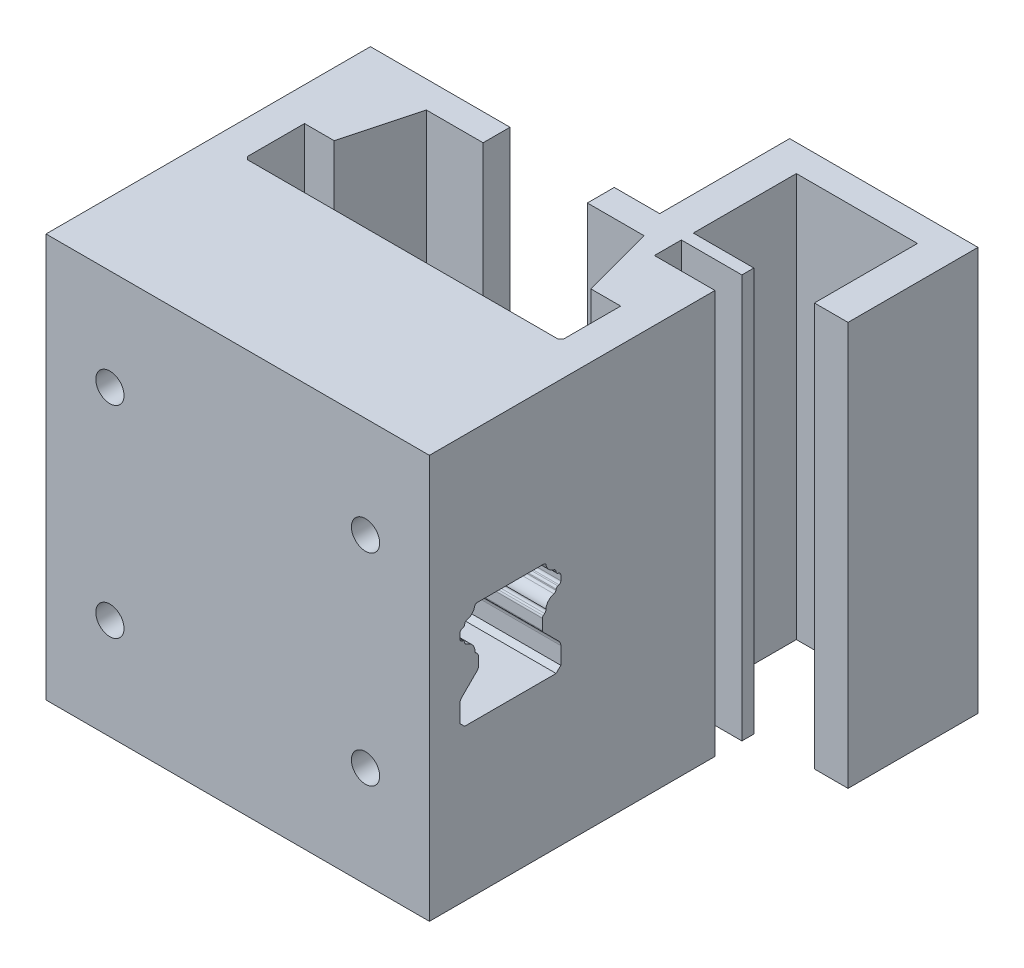
from build123d import *

# Parameters (mm, degrees)
SKETCH1_W           = 57
SKETCH1_H           = 28.7
BOSS_EXTRUDE1_DEPTH = 60
SKETCH2_W           = 9
SKETCH2_H           = 4
CUT_EXTRUDE1_DEPTH  = 69.064473112
BOSS_EXTRUDE2_DEPTH = 28.5
SKETCH6_W           = 15.5
SKETCH6_H           = 15.390476131
CUT_EXTRUDE2_DEPTH  = 80
BOSS_EXTRUDE5_DEPTH = 60
SKETCH10_R          = 2.1
CUT_EXTRUDE3_DEPTH  = 24.530533394
SKETCH11_W          = 40.163550966
SKETCH11_H          = 20.084690285
CUT_EXTRUDE4_DEPTH  = 82.168165413
SKETCH12_W          = 9
SKETCH12_H          = 4
BOSS_EXTRUDE6_DEPTH = 60


with BuildPart() as part:
    # Sketch1 → Boss-Extrude1 (new body)
    with BuildSketch(Plane(origin=(0, 0, 0), x_dir=(1, 0, 0), z_dir=(0, 1, 0))):
        with Locations((0, -0.5)):
            Rectangle(SKETCH1_W, SKETCH1_H)
        Polygon((23.07, -9.85), (-23.07, -9.85), (-23.5, -9.42), (-23.5, -0.95), (-19.09385128, -0.95), (-19, -0.599742255), (-16.2, 9.85), (16.2, 9.85), (19, -0.599742255), (19.09385128, -0.95), (23.5, -0.95), (23.5, -2.9), (23.5, -9.42), align=None, mode=Mode.SUBTRACT)
    extrude(amount=BOSS_EXTRUDE1_DEPTH)

    # Sketch2 → Cut-Extrude1 (cut, through all)
    with BuildSketch(Plane.XZ):
        with Locations((24, -10.0706285)):
            Rectangle(SKETCH2_W, SKETCH2_H)
        with Locations((-24, -10.0706285)):
            Rectangle(SKETCH2_W, SKETCH2_H)
    extrude(amount=-CUT_EXTRUDE1_DEPTH, mode=Mode.SUBTRACT)

    # Sketch5 → Boss-Extrude2 (add, symmetric)
    with BuildSketch(Plane(origin=(0, 0, 0), x_dir=(0, 0, -1), z_dir=(1, 0, 0))):
        with BuildLine():
            Line((-14.85, 0), (-14.85, 23.200000017))
            Line((-14.85, 23.200000017), (-15.549999973, 22.50000003))
            Line((-15.549999973, 22.50000003), (-29.149999973, 22.50000003))
            Line((-29.149999973, 22.50000003), (-29.849999973, 23.20000003))
            Line((-29.849999973, 23.20000003), (-29.849999973, 25.743360053))
            ThreePointArc((-29.849999973, 25.743360053), (-29.773879502, 26.126043492), (-29.557106746, 26.450466847))
            Line((-29.557106746, 26.450466847), (-27.237157266, 28.770416328))
            ThreePointArc((-27.237157266, 28.770416328), (-27.150448162, 28.900185674), (-27.119999973, 29.053259055))
            Line((-27.119999973, 29.053259055), (-27.119999973, 30.615319642))
            ThreePointArc((-27.119999973, 30.615319642), (-27.150448164, 30.768393021), (-27.237157268, 30.898162365))
            Line((-27.237157268, 30.898162365), (-27.431588163, 31.09259326))
            ThreePointArc((-27.431588163, 31.09259326), (-27.613507965, 31.297692563), (-27.620638933, 31.57175403))
            ThreePointArc((-27.620638933, 31.57175403), (-28.017573243, 32.42857618), (-28.828543655, 32.91234062))
            ThreePointArc((-28.828543655, 32.91234062), (-29.01918836, 33.020436377), (-29.124259054, 33.212764861))
            Line((-29.124259054, 33.212764861), (-29.156235284, 33.354092333))
            ThreePointArc((-29.156235284, 33.354092333), (-29.24659278, 33.53064407), (-29.410649592, 33.642090719))
            Line((-29.410649592, 33.642090719), (-29.585724304, 33.70524196))
            ThreePointArc((-29.585724304, 33.70524196), (-29.777329878, 33.851609246), (-29.849999973, 34.081511694))
            Line((-29.849999973, 34.081511694), (-29.849999973, 34.837490602))
            ThreePointArc((-29.849999973, 34.837490602), (-29.772088513, 35.074680338), (-29.568705112, 35.219471078))
            Line((-29.568705112, 35.219471078), (-29.427668799, 35.263299846))
            ThreePointArc((-29.427668799, 35.263299846), (-29.25116358, 35.375371369), (-29.155313737, 35.561185593))
            Line((-29.155313737, 35.561185593), (-29.125010632, 35.702102112))
            ThreePointArc((-29.125010632, 35.702102112), (-29.020526118, 35.897067182), (-28.828406063, 36.006695082))
            ThreePointArc((-28.828406063, 36.006695082), (-28.025619489, 36.481556021), (-27.62403672, 37.32339358))
            ThreePointArc((-27.62403672, 37.32339358), (-27.540484938, 37.407225271), (-27.43605838, 37.46293655))
            Line((-27.43605838, 37.46293655), (-27.39899493, 37.5))
            Line((-27.39899493, 37.5), (-17.30100503, 37.5))
            Line((-17.30100503, 37.5), (-17.26394158, 37.46293655))
            ThreePointArc((-17.26394158, 37.46293655), (-17.159515017, 37.407225278), (-17.07596324, 37.32339358))
            ThreePointArc((-17.07596324, 37.32339358), (-16.674380468, 36.481556018), (-15.871593887, 36.006695079))
            ThreePointArc((-15.871593887, 36.006695079), (-15.679473839, 35.897067189), (-15.574989331, 35.702102127))
            Line((-15.574989331, 35.702102127), (-15.544686222, 35.561185587))
            ThreePointArc((-15.544686222, 35.561185587), (-15.448836377, 35.375371364), (-15.272331158, 35.263299843))
            Line((-15.272331158, 35.263299843), (-15.131294869, 35.219471083))
            ThreePointArc((-15.131294869, 35.219471083), (-14.927911462, 35.074680333), (-14.85, 34.837490586))
            Line((-14.85, 34.837490586), (-14.85, 60))
            Line((-14.85, 60), (-34.380533394, 60))
            Line((-34.380533394, 60), (-34.380533394, 0))
            Line((-34.380533394, 0), (-14.85, 0))
        make_face()
        with BuildLine():
            ThreePointArc((-15.142893227, 26.450466847), (-14.926120471, 26.126043492), (-14.85, 25.743360053))
            Line((-14.85, 25.743360053), (-14.85, 34.081511674))
            ThreePointArc((-14.85, 34.081511674), (-14.922670087, 33.851609245), (-15.114275644, 33.70524197))
            Line((-15.114275644, 33.70524197), (-15.289350386, 33.642090718))
            ThreePointArc((-15.289350386, 33.642090718), (-15.453407192, 33.53064407), (-15.543764688, 33.354092339))
            Line((-15.543764688, 33.354092339), (-15.57574092, 33.21276486))
            ThreePointArc((-15.57574092, 33.21276486), (-15.680811613, 33.020436377), (-15.871456319, 32.91234062))
            ThreePointArc((-15.871456319, 32.91234062), (-16.68242673, 32.42857618), (-17.07936104, 31.57175403))
            ThreePointArc((-17.07936104, 31.57175403), (-17.086492012, 31.297692565), (-17.26841181, 31.09259326))
            Line((-17.26841181, 31.09259326), (-17.462842708, 30.898162362))
            ThreePointArc((-17.462842708, 30.898162362), (-17.549551812, 30.768393016), (-17.58, 30.615319635))
            Line((-17.58, 30.615319635), (-17.58, 29.053259048))
            ThreePointArc((-17.58, 29.053259048), (-17.54955181, 28.900185669), (-17.462842705, 28.770416325))
            Line((-17.462842705, 28.770416325), (-15.142893227, 26.450466847))
        make_face()
    extrude(amount=BOSS_EXTRUDE2_DEPTH, both=True)

    # Sketch6 → Cut-Extrude2 (cut)
    with BuildSketch(Plane(origin=(0, 60, 0), x_dir=(1, 0, 0), z_dir=(0, 1, 0))):
        with Locations((0, 12.050145064)):
            Rectangle(SKETCH6_W, SKETCH6_H)
    extrude(amount=-CUT_EXTRUDE2_DEPTH, mode=Mode.SUBTRACT)

    # Sketch9 → Boss-Extrude5 (add)
    with BuildSketch(Plane(origin=(0, 60, 0), x_dir=(1, 0, 0), z_dir=(0, 1, 0))):
        Polygon((-19.5, 13.85), (-19.5, 29.1706285), (-37.5, 29.1706285), (-37.5, 13.85), (-42.5, 13.85), (-42.5, 33.1706285), (-14.5, 33.1706285), (-14.5, 13.85), align=None)
        Polygon((37.5, 13.85), (37.5, 29.1706285), (19.5, 29.1706285), (19.5, 13.85), (14.5, 13.85), (14.5, 33.1706285), (42.5, 33.1706285), (42.5, 13.85), align=None)
    extrude(amount=-BOSS_EXTRUDE5_DEPTH)

    # Sketch10 → Cut-Extrude3 (cut)
    with BuildSketch(Plane.XY.offset(34.380533394)):
        with Locations((-19, 45)):
            Circle(SKETCH10_R)
        with Locations((19, 45)):
            Circle(SKETCH10_R)
        with Locations((-19, 15)):
            Circle(SKETCH10_R)
        with Locations((19, 15)):
            Circle(SKETCH10_R)
    extrude(amount=-CUT_EXTRUDE3_DEPTH, mode=Mode.SUBTRACT)

    # Sketch11 → Cut-Extrude4 (cut, through all)
    with BuildSketch(Plane.XZ):
        with Locations((-27.831775483, -23.892345143)):
            Rectangle(SKETCH11_W, SKETCH11_H)
    extrude(amount=-CUT_EXTRUDE4_DEPTH, mode=Mode.SUBTRACT)

    # Sketch12 → Boss-Extrude6 (add, through all)
    with BuildSketch(Plane(origin=(0, 0, 0), x_dir=(-1, 0, 0), z_dir=(0, -1, 0))):
        with Locations((24, 10.0706285)):
            Rectangle(SKETCH12_W, SKETCH12_H)
    extrude(amount=-BOSS_EXTRUDE6_DEPTH)


solid = part.part
